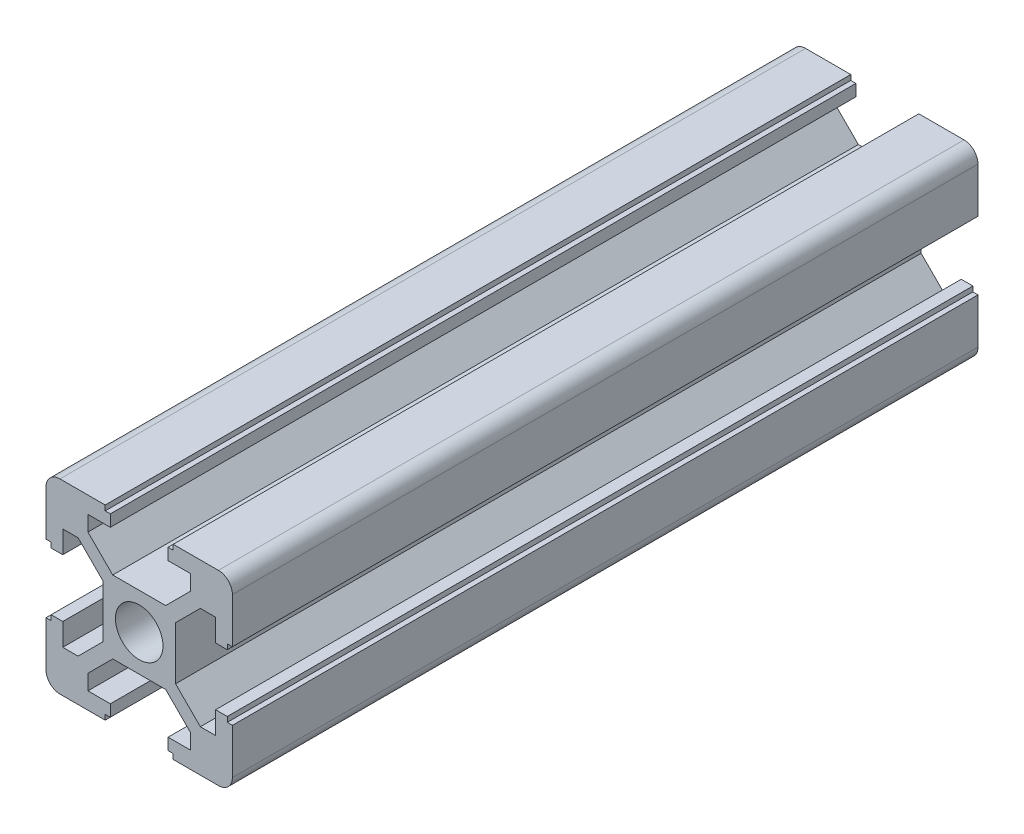
from build123d import *

# Parameters (mm, degrees)
SKETCH_2_R      = 2.55
EXTRUDE_1_DEPTH = 80


with BuildPart() as part:
    # 草图2 → 凸台-拉伸1 (new body)
    with BuildSketch(Plane.XY):
        with BuildLine():
            Line((-3.9, 2.839339828), (-6.560660172, 5.5))
            Line((-6.560660172, 5.5), (-8.2, 5.5))
            Line((-8.2, 5.5), (-8.2, 3.1))
            Line((-8.2, 3.1), (-9.45, 3.1))
            Line((-9.45, 3.1), (-9.45, 3.65))
            Line((-9.45, 3.65), (-10, 3.65))
            Line((-10, 3.65), (-10, 8.5))
            ThreePointArc((-10, 8.5), (-9.560660172, 9.560660172), (-8.5, 10))
            Line((-8.5, 10), (-3.65, 10))
            Line((-3.65, 10), (-3.65, 9.45))
            Line((-3.65, 9.45), (-3.1, 9.45))
            Line((-3.1, 9.45), (-3.1, 8.2))
            Line((-3.1, 8.2), (-5.5, 8.2))
            Line((-5.5, 8.2), (-5.5, 6.560660172))
            Line((-5.5, 6.560660172), (-2.839339828, 3.9))
            Line((-2.839339828, 3.9), (2.839339828, 3.9))
            Line((2.839339828, 3.9), (5.5, 6.560660172))
            Line((5.5, 6.560660172), (5.5, 8.2))
            Line((5.5, 8.2), (3.1, 8.2))
            Line((3.1, 8.2), (3.1, 9.45))
            Line((3.1, 9.45), (3.65, 9.45))
            Line((3.65, 9.45), (3.65, 10))
            Line((3.65, 10), (8.5, 10))
            ThreePointArc((8.5, 10), (9.560660172, 9.560660172), (10, 8.5))
            Line((10, 8.5), (10, 3.65))
            Line((10, 3.65), (9.45, 3.65))
            Line((9.45, 3.65), (9.45, 3.1))
            Line((9.45, 3.1), (8.2, 3.1))
            Line((8.2, 3.1), (8.2, 5.5))
            Line((8.2, 5.5), (6.560660172, 5.5))
            Line((6.560660172, 5.5), (3.9, 2.839339828))
            Line((3.9, 2.839339828), (3.9, -2.839339828))
            Line((3.9, -2.839339828), (6.560660172, -5.5))
            Line((6.560660172, -5.5), (8.2, -5.5))
            Line((8.2, -5.5), (8.2, -3.1))
            Line((8.2, -3.1), (9.45, -3.1))
            Line((9.45, -3.1), (9.45, -3.65))
            Line((9.45, -3.65), (10, -3.65))
            Line((10, -3.65), (10, -8.5))
            ThreePointArc((10, -8.5), (9.560660172, -9.560660172), (8.5, -10))
            Line((8.5, -10), (3.65, -10))
            Line((3.65, -10), (3.65, -9.45))
            Line((3.65, -9.45), (3.1, -9.45))
            Line((3.1, -9.45), (3.1, -8.2))
            Line((3.1, -8.2), (5.5, -8.2))
            Line((5.5, -8.2), (5.5, -6.560660172))
            Line((5.5, -6.560660172), (2.839339828, -3.9))
            Line((2.839339828, -3.9), (-2.839339828, -3.9))
            Line((-2.839339828, -3.9), (-5.5, -6.560660172))
            Line((-5.5, -6.560660172), (-5.5, -8.2))
            Line((-5.5, -8.2), (-3.1, -8.2))
            Line((-3.1, -8.2), (-3.1, -9.45))
            Line((-3.1, -9.45), (-3.65, -9.45))
            Line((-3.65, -9.45), (-3.65, -10))
            Line((-3.65, -10), (-8.5, -10))
            ThreePointArc((-8.5, -10), (-9.560660172, -9.560660172), (-10, -8.5))
            Line((-10, -8.5), (-10, -3.65))
            Line((-10, -3.65), (-9.45, -3.65))
            Line((-9.45, -3.65), (-9.45, -3.1))
            Line((-9.45, -3.1), (-8.2, -3.1))
            Line((-8.2, -3.1), (-8.2, -5.5))
            Line((-8.2, -5.5), (-6.560660172, -5.5))
            Line((-6.560660172, -5.5), (-3.9, -2.839339828))
            Line((-3.9, -2.839339828), (-3.9, 2.839339828))
        make_face()
        Circle(SKETCH_2_R, mode=Mode.SUBTRACT)
    extrude(amount=EXTRUDE_1_DEPTH)


solid = part.part
